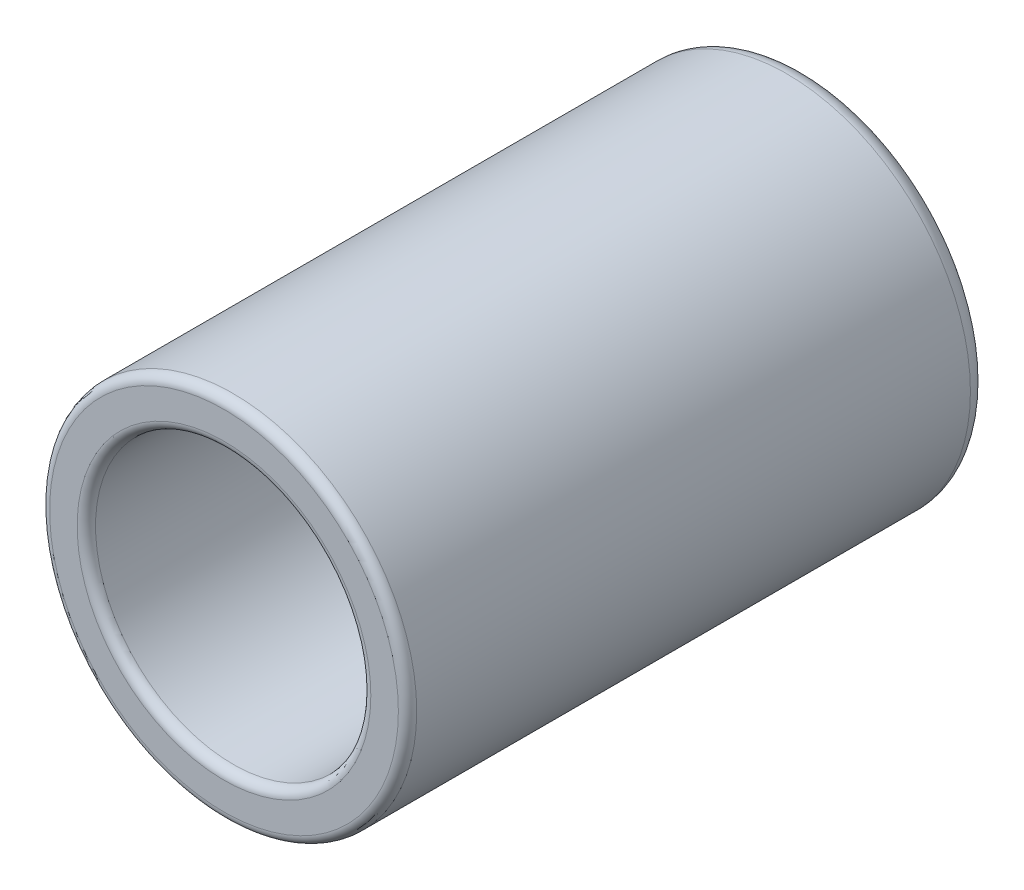
from build123d import *

# Parameters (mm, degrees)
SKETCH1_R           = 3
BOSS_EXTRUDE1_DEPTH = 9.5
SKETCH2_R           = 2.25
CUT_EXTRUDE1_DEPTH  = 3.5
SKETCH3_R           = 1.25
CUT_EXTRUDE2_DEPTH  = 6
FILLET1_R           = 0.15
FILLET2_R           = 0.3


with BuildPart() as part:
    # Sketch1 → Boss-Extrude1 (new body)
    with BuildSketch(Plane.XY):
        Circle(SKETCH1_R)
    extrude(amount=BOSS_EXTRUDE1_DEPTH)

    # Sketch2 → Cut-Extrude1 (cut)
    with BuildSketch(Plane.XY.offset(9.5)):
        Circle(SKETCH2_R)
    extrude(amount=-CUT_EXTRUDE1_DEPTH, mode=Mode.SUBTRACT)

    # Sketch3 → Cut-Extrude2 (cut)
    with BuildSketch(Plane.XY.offset(6)):
        Circle(SKETCH3_R)
    extrude(amount=-CUT_EXTRUDE2_DEPTH, mode=Mode.SUBTRACT)

    # Fillet1
    fillet1_edges = [part.edges().sort_by_distance(p)[0] for p in [
        (-3, 0, 9.5),
        (-2.25, 0, 9.5),
    ]]
    fillet(fillet1_edges, radius=FILLET1_R)

    # Fillet2
    fillet2_edges = [part.edges().sort_by_distance(p)[0] for p in [
        (-3, 0, 0),
    ]]
    fillet(fillet2_edges, radius=FILLET2_R)


solid = part.part
